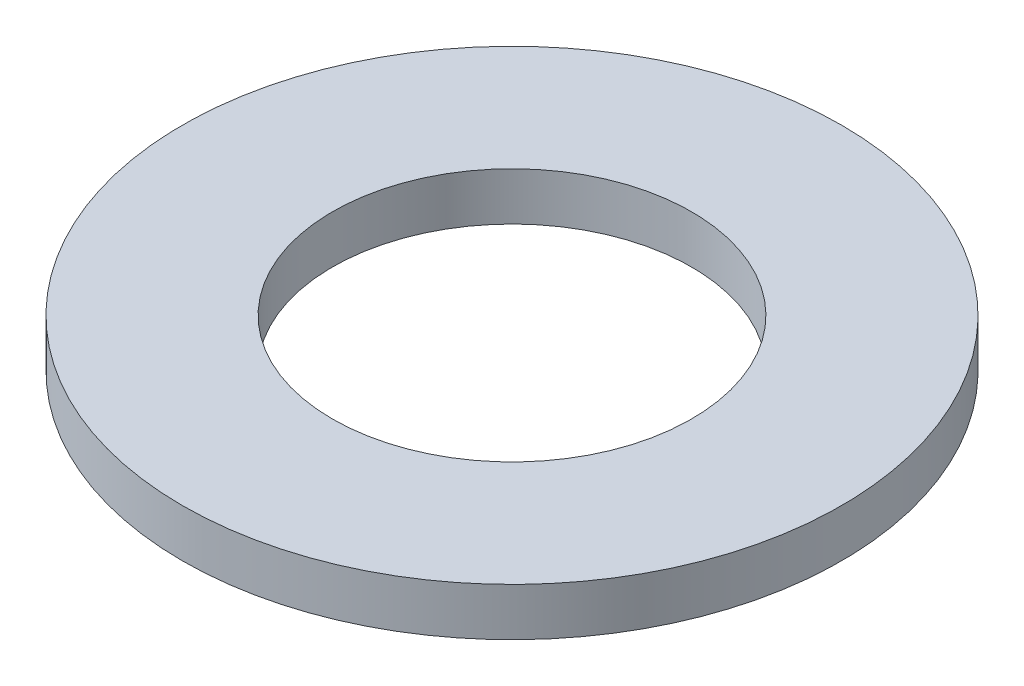
from build123d import *

# Parameters (mm, degrees)
SKETCH1_R           = 5.9436
BOSS_EXTRUDE1_DEPTH = 0.8636
SKETCH5_R           = 3.2385
CUT_EXTRUDE1_DEPTH  = 9.449767268


with BuildPart() as part:
    # Sketch1 → Boss-Extrude1 (new body)
    with BuildSketch(Plane(origin=(0, 0, 0), x_dir=(1, 0, 0), z_dir=(0, 1, 0))):
        with Locations(Location((0, 0, 0), (0, 0, 270))):
            Circle(SKETCH1_R)
    extrude(amount=BOSS_EXTRUDE1_DEPTH)

    # Sketch5 → Cut-Extrude1 (cut, through all)
    with BuildSketch(Plane(origin=(0, 0.8636, 0), x_dir=(-1, 0, 0), z_dir=(0, 1, 0))):
        with Locations(Location((0, 0, 0), (0, 0, 90))):
            Circle(SKETCH5_R)
    extrude(amount=-CUT_EXTRUDE1_DEPTH, mode=Mode.SUBTRACT)


solid = part.part
